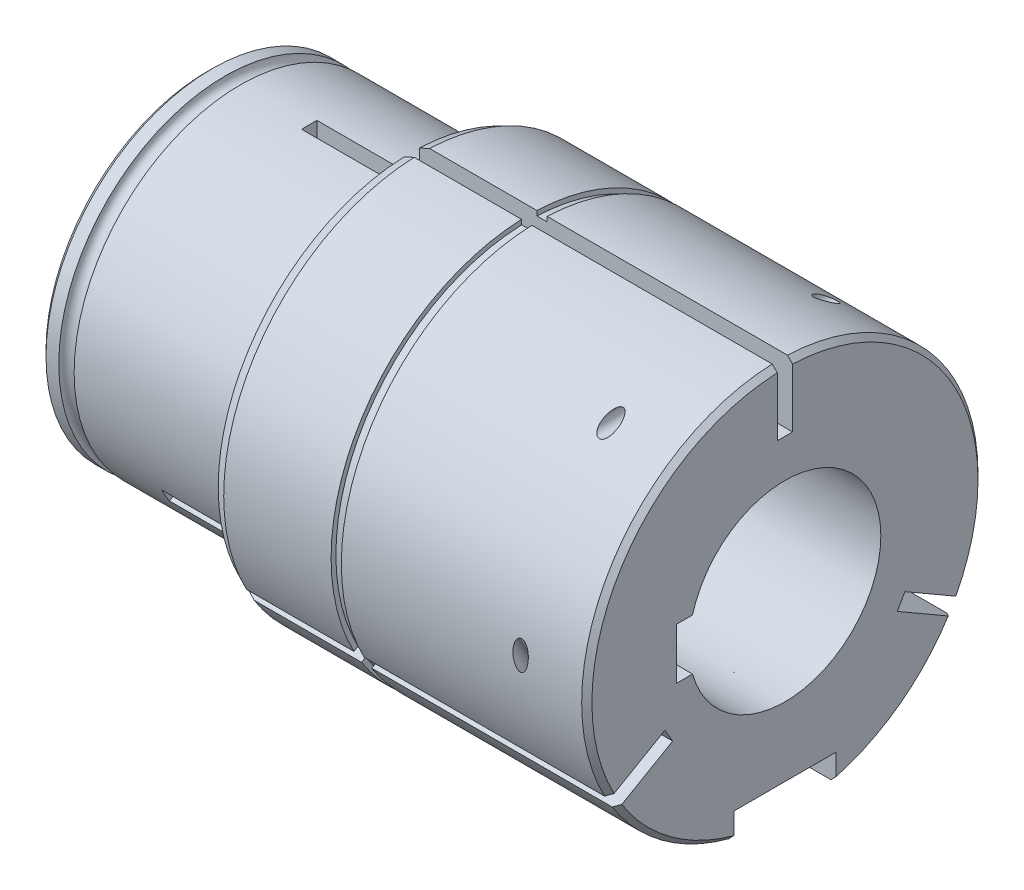
from build123d import *

# Parameters (mm, degrees)
CHAMFER_1_SIZE                   = 2
CUT_EXTRUDE_1_DEPTH              = 186
FILLET_1_R                       = 5
PATTERN_CIRCULAR_1_COUNT         = 3
FILLET_1_OF_PATTERN_CIRCULAR_1_R = 5
SKETCH_3_R                       = 3
CUT_EXTRUDE_2_DEPTH              = 187.053219008
PATTERN_CIRCULAR_2_COUNT         = 3
SKETCH_4_W                       = 13.694709433
SKETCH_4_H                       = 20
CUT_EXTRUDE_3_DEPTH              = 146
SKETCH_5_W                       = 40
SKETCH_5_H                       = 21.638240518
CUT_EXTRUDE_4_DEPTH              = 146
HOLE_WIZARD_M121_D               = 10.2
HOLE_WIZARD_M121_DEPTH           = 24
HOLE_WIZARD_M121_TIP             = 3.064389157


with BuildPart() as part:
    # Эскиз1 → Повернуть1 (revolve)
    with BuildSketch(Plane.XY, mode=Mode.PRIVATE) as revolve_1_sk:
        with BuildLine():
            Line((-75.656059972, 45), (4.343940028, 45))
            Line((4.343940028, 45), (4.343940028, 37.5))
            Line((4.343940028, 37.5), (150.343940028, 37.5))
            Line((150.343940028, 37.5), (150.343940028, 77.5))
            Line((150.343940028, 77.5), (54.343940028, 77.5))
            Line((54.343940028, 77.5), (54.343940028, 75.634769367))
            Line((54.343940028, 75.634769367), (50.343940028, 75.634769367))
            Line((50.343940028, 75.634769367), (50.343940028, 77.5))
            Line((50.343940028, 77.5), (8.343940028, 77.5))
            Line((8.343940028, 77.5), (4.343940028, 75.634769367))
            Line((4.343940028, 75.634769367), (4.343940028, 65))
            Line((4.343940028, 65), (-62.656059972, 65))
            ThreePointArc((-62.656059972, 65), (-65.656059972, 62), (-68.656059972, 65))
            Line((-68.656059972, 65), (-75.656059972, 65))
            Line((-75.656059972, 65), (-75.656059972, 45))
        make_face()
    revolve(revolve_1_sk.sketch.rotate(Axis((-97.05, 0, 0), (1, 0, 0)), 90), axis=Axis((-97.05, 0, 0), (1, 0, 0)))

    # Фаска1
    chamfer_1_edges = [part.edges().sort_by_distance(p)[0] for p in [
        (-75.656059972, 0, -65),
        (150.343940028, 0, -77.5),
        (4.343940028, 0, -37.5),
    ]]
    chamfer(chamfer_1_edges, length=CHAMFER_1_SIZE)

    # Эскиз2 → Вырез-Вытянуть1 (cut)
    with BuildSketch(Plane(origin=(150.343940028, 0, 0), x_dir=(0, 0, -1), z_dir=(1, 0, 0))):
        Polygon((-3, 77.441913716), (-3, 78.906018197), (3, 78.906018197), (3, 77.441913716), (3, 52.441913716), (-3, 52.441913716), align=None)
    cut_extrude_1 = extrude(amount=-CUT_EXTRUDE_1_DEPTH, mode=Mode.SUBTRACT)

    # Скругление1
    fillet_1_edges = [part.edges().sort_by_distance(p)[0] for p in [
        (-35.656059972, 52.441913716, 0),
    ]]
    fillet(fillet_1_edges, radius=FILLET_1_R)

    # Круговой массив1: Вырез-Вытянуть1 ×3 about axis
    pattern_circular_1_axis = Axis((0, 0, 0), (1, 0, 0))
    for i in range(1, PATTERN_CIRCULAR_1_COUNT):
        add(cut_extrude_1.rotate(pattern_circular_1_axis, i * 360 / PATTERN_CIRCULAR_1_COUNT), mode=Mode.SUBTRACT)

    # Скругление1 of Круговой массив1
    fillet_1_of_pattern_circular_1_edges = [part.edges().sort_by_distance(p)[0] for p in [
        (-35.656059972, -26.220956858, 45.416029501),
        (-35.656059972, -26.220956858, -45.416029501),
    ]]
    fillet(fillet_1_of_pattern_circular_1_edges, radius=FILLET_1_OF_PATTERN_CIRCULAR_1_R)

    # Эскиз3 → Вырез-Вытянуть2 (cut, symmetric)
    with BuildSketch(Plane.XY):
        with Locations((124.343940028, 64.941913716)):
            Circle(SKETCH_3_R)
    cut_extrude_2 = extrude(amount=CUT_EXTRUDE_2_DEPTH, both=True, mode=Mode.SUBTRACT)

    # Круговой массив2: Вырез-Вытянуть2 ×3 about axis
    pattern_circular_2_axis = Axis((148.343940028, 0, 0), (-1, 0, 0))
    for i in range(1, PATTERN_CIRCULAR_2_COUNT):
        add(cut_extrude_2.rotate(pattern_circular_2_axis, i * 360 / PATTERN_CIRCULAR_2_COUNT), mode=Mode.SUBTRACT)

    # Эскиз4 → Вырез-Вытянуть3 (cut)
    with BuildSketch(Plane(origin=(150.343940028, 0, 0), x_dir=(0, 0, -1), z_dir=(1, 0, 0))):
        with Locations((-35.552645284, 0)):
            Rectangle(SKETCH_4_W, SKETCH_4_H)
    extrude(amount=-CUT_EXTRUDE_3_DEPTH, mode=Mode.SUBTRACT)

    # Эскиз5 → Вырез-Вытянуть4 (cut)
    with BuildSketch(Plane(origin=(150.343940028, 0, 0), x_dir=(0, 0, -1), z_dir=(1, 0, 0))):
        with Locations((0, -75.319120259)):
            Rectangle(SKETCH_5_W, SKETCH_5_H)
    extrude(amount=-CUT_EXTRUDE_4_DEPTH, mode=Mode.SUBTRACT)

    # Отверстие обработанное метчиком M121
    with Locations(Plane(origin=(0, -64.5, 0), x_dir=(-1, 0, 0), z_dir=(0, -1, 0))):
        with Locations((-70.343940028, 0), (-130.343940028, 0)):
            Hole(HOLE_WIZARD_M121_D / 2, depth=HOLE_WIZARD_M121_DEPTH)
            with Locations((0, 0, -(HOLE_WIZARD_M121_DEPTH + HOLE_WIZARD_M121_TIP / 2))):  # 118° drill point
                Cone(0, HOLE_WIZARD_M121_D / 2, HOLE_WIZARD_M121_TIP, mode=Mode.SUBTRACT)


solid = part.part
